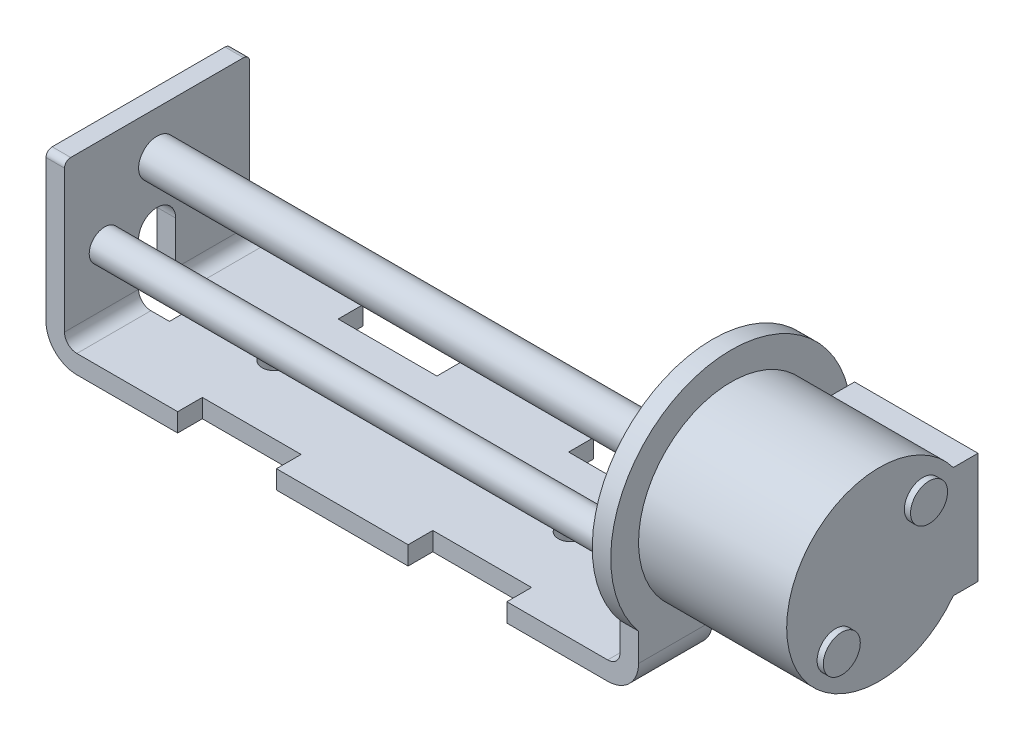
from build123d import *

# Parameters (mm, degrees)
BOSS_EXTRUDE1_DEPTH = 7.5
BOSS_EXTRUDE2_DEPTH = 1.5
SKETCH4_R           = 7.5
BOSS_EXTRUDE3_DEPTH = 12
SKETCH5_R           = 1.5
SKETCH5_R_2         = 1.25
BOSS_EXTRUDE4_DEPTH = 46.5
SKETCH6_R           = 1
CUT_EXTRUDE1_DEPTH  = 1.5
SKETCH7_R           = 1.5
BOSS_EXTRUDE5_DEPTH = 0.5
SKETCH8_W           = 8
SKETCH8_H           = 2
CUT_EXTRUDE2_DEPTH  = 53.627226794
FILLET1_R           = 0.5
SKETCH9_W           = 3
SKETCH9_H           = 3.5
SKETCH9_H_2         = 8.5
CUT_EXTRUDE3_DEPTH  = 4
SKETCH10_W          = 3
SKETCH10_H          = 6
CUT_EXTRUDE4_DEPTH  = 4
SKETCH12_W          = 10
SKETCH12_H          = 9
BOSS_EXTRUDE6_DEPTH = 8


with BuildPart() as part:
    # Sketch1 → Boss-Extrude1 (new, symmetric)
    with BuildSketch(Plane.XY):
        with BuildLine():
            Line((-46.5, 14.5), (-48, 14.5))
            Line((-48, 14.5), (-48, 2.5))
            ThreePointArc((-48, 2.5), (-47.267766953, 0.732233047), (-45.5, 0))
            Line((-45.5, 0), (-2.5, 0))
            ThreePointArc((-2.5, 0), (-0.732233047, 0.732233047), (0, 2.5))
            Line((0, 2.5), (0, 14.5))
            Line((0, 14.5), (-1.5, 14.5))
            Line((-1.5, 14.5), (-1.5, 2.5))
            ThreePointArc((-1.5, 2.5), (-1.792893219, 1.792893219), (-2.5, 1.5))
            Line((-2.5, 1.5), (-45.5, 1.5))
            ThreePointArc((-45.5, 1.5), (-46.207106781, 1.792893219), (-46.5, 2.5))
            Line((-46.5, 2.5), (-46.5, 14.5))
        make_face()
    extrude(amount=BOSS_EXTRUDE1_DEPTH, both=True)

    # Sketch3 → Boss-Extrude2 (add)
    with BuildSketch(Plane(origin=(0, 0, 0), x_dir=(0, 0, -1), z_dir=(1, 0, 0))):
        with BuildLine():
            ThreePointArc((7.5, 4.770032103), (9.170264445, 7.688089675), (9.75, 11))
            ThreePointArc((9.75, 11), (-3.311910325, 20.170264445), (-7.5, 4.770032103))
            Line((-7.5, 4.770032103), (-7.5, 14.5))
            Line((-7.5, 14.5), (7.5, 14.5))
            Line((7.5, 14.5), (7.5, 4.770032103))
        make_face()
    extrude(amount=-BOSS_EXTRUDE2_DEPTH)

    # Sketch4 → Boss-Extrude3 (add)
    with BuildSketch(Plane(origin=(0, 0, 0), x_dir=(0, 0, -1), z_dir=(1, 0, 0))):
        with Locations((0, 11)):
            Circle(SKETCH4_R)
    extrude(amount=BOSS_EXTRUDE3_DEPTH)

    # Sketch5 → Boss-Extrude4 (add)
    with BuildSketch(Plane.ZY.offset(48)):
        with Locations(Location((0, 11, 0), (0, 0, 90))):
            Circle(SKETCH5_R)
        with Locations(Location((4.25, 7, 0), (0, 0, 90))):
            Circle(SKETCH5_R_2)
        with Locations(Location((-4.25, 7, 0), (0, 0, 90))):
            Circle(SKETCH5_R_2)
    extrude(amount=-BOSS_EXTRUDE4_DEPTH)

    # Sketch6 → Cut-Extrude1 (cut)
    with BuildSketch(Plane.XZ):
        with Locations((-37, 0)):
            Circle(SKETCH6_R)
        with Locations((-13, 0)):
            Circle(SKETCH6_R)
    extrude(amount=-CUT_EXTRUDE1_DEPTH, mode=Mode.SUBTRACT)

    # Sketch7 → Boss-Extrude5 (add)
    with BuildSketch(Plane(origin=(12, 0, 0), x_dir=(0, 0, -1), z_dir=(1, 0, 0))):
        with Locations((3.535533906, 14.535533906)):
            Circle(SKETCH7_R)
        with Locations((-3.535533906, 7.464466094)):
            Circle(SKETCH7_R)
    extrude(amount=BOSS_EXTRUDE5_DEPTH)

    # Sketch8 → Cut-Extrude2 (cut, through all)
    with BuildSketch(Plane(origin=(0, 1.5, 0), x_dir=(1, 0, 0), z_dir=(0, 1, 0))):
        with Locations((-33.333333333, -6.5)):
            Rectangle(SKETCH8_W, SKETCH8_H)
        with Locations((-14.666666667, -6.5)):
            Rectangle(SKETCH8_W, SKETCH8_H)
        with Locations((-14.666666667, 6.5)):
            Rectangle(SKETCH8_W, SKETCH8_H)
        with Locations((-33.333333333, 6.5)):
            Rectangle(SKETCH8_W, SKETCH8_H)
    extrude(amount=-CUT_EXTRUDE2_DEPTH, mode=Mode.SUBTRACT)

    # Fillet1
    fillet1_edges = [part.edges().sort_by_distance(p)[0] for p in [
        (-47.25, 14.5, -7.5),
        (-47.25, 14.5, 7.5),
    ]]
    fillet(fillet1_edges, radius=FILLET1_R)

    # Sketch9 → Cut-Extrude3 (cut)
    with BuildSketch(Plane.ZY.offset(48)):
        with BuildLine():
            Line((-1.5, 6), (1.5, 6))
            ThreePointArc((1.5, 6), (0, 7.5), (-1.5, 6))
        make_face()
        with Locations((0, 4.25)):
            Rectangle(SKETCH9_W, SKETCH9_H)
        with Locations((0, -1.75)):
            Rectangle(SKETCH9_W, SKETCH9_H_2)
    extrude(amount=-CUT_EXTRUDE3_DEPTH, mode=Mode.SUBTRACT)

    # Sketch10 → Cut-Extrude4 (cut)
    with BuildSketch(Plane(origin=(0, 0, 0), x_dir=(0, 0, -1), z_dir=(1, 0, 0))):
        Rectangle(SKETCH10_W, SKETCH10_H)
    extrude(amount=-CUT_EXTRUDE4_DEPTH, mode=Mode.SUBTRACT)

    # Sketch12 → Boss-Extrude6 (add)
    with BuildSketch(Plane.XY):
        with Locations((7, 11)):
            Rectangle(SKETCH12_W, SKETCH12_H)
    extrude(amount=-BOSS_EXTRUDE6_DEPTH)


solid = part.part
